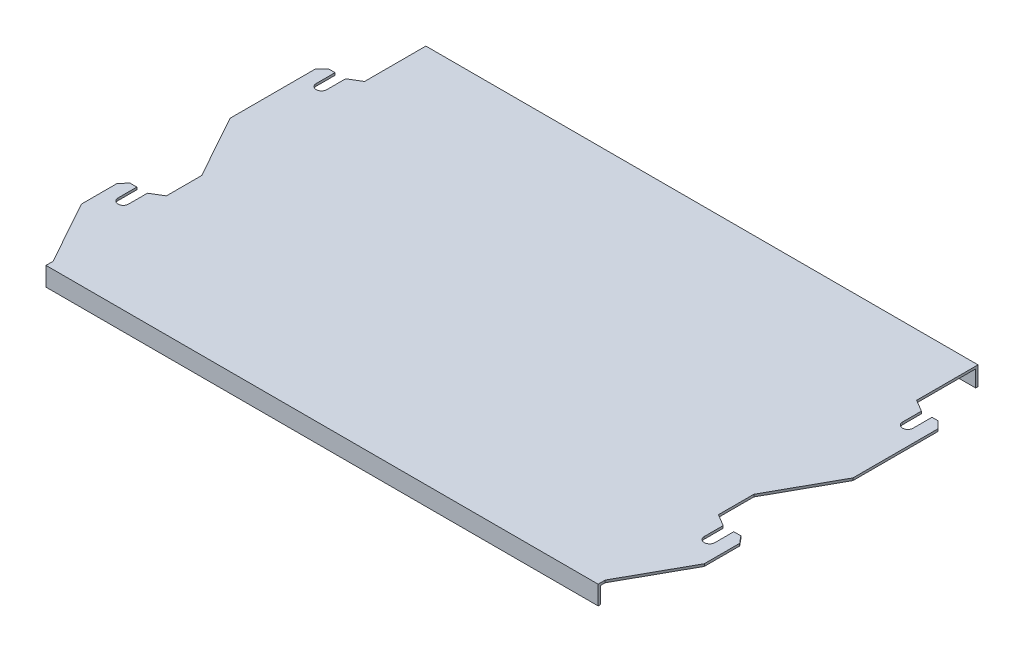
from build123d import *

# Parameters (mm, degrees)
EXTRUDE_THIN1_DEPTH = 132
CUT_EXTRUDE1_DEPTH  = 10


with BuildPart() as part:
    # Sketch1 → Extrude-Thin1 (new, symmetric)
    with BuildSketch(Plane(origin=(0, 0, 0), x_dir=(0, 0, -1), z_dir=(1, 0, 0))):
        Polygon((-80.5, -8), (-80.5, 0), (80.5, 0), (80.5, -8), (79.5, -8), (79.5, -1), (-79.5, -1), (-79.5, -8), align=None)
    extrude(amount=EXTRUDE_THIN1_DEPTH, both=True)

    # Sketch2 → Cut-Extrude1 (cut)
    with BuildSketch(Plane(origin=(0, 0, 0), x_dir=(1, 0, 0), z_dir=(0, 1, 0))):
        with BuildLine():
            Line((-117, 80.5), (-117, 54.5))
            Line((-117, 54.5), (-122, 51.5))
            Line((-122, 51.5), (-122, 43.5))
            ThreePointArc((-122, 43.5), (-124.25, 41.25), (-126.5, 43.5))
            Line((-126.5, 43.5), (-126.5, 51.5))
            Line((-126.5, 51.5), (-129, 51.5))
            Line((-129, 51.5), (-132, 48.5))
            Line((-132, 48.5), (-132, 12.5))
            Line((-132, 12.5), (-117, -14.5))
            Line((-117, -14.5), (-117, -29.5))
            Line((-117, -29.5), (-122, -32.5))
            Line((-122, -32.5), (-122, -40.5))
            ThreePointArc((-122, -40.5), (-124.25, -42.75), (-126.5, -40.5))
            Line((-126.5, -40.5), (-126.5, -32.5))
            Line((-126.5, -32.5), (-129.5, -32.5))
            Line((-129.5, -32.5), (-132, -35.5))
            Line((-132, -35.5), (-132, -50.5))
            Line((-132, -50.5), (-117, -77.5))
            Line((-117, -77.5), (-117, -80.5))
            Line((-117, -80.5), (-140, -80.5))
            Line((-140, -80.5), (-140, 80.5))
            Line((-140, 80.5), (-117, 80.5))
        make_face()
    cut_extrude1 = extrude(amount=-CUT_EXTRUDE1_DEPTH, mode=Mode.SUBTRACT)

    # Mirror1: Cut-Extrude1 across plane
    add(cut_extrude1.mirror(Plane(origin=(0, 0, 0), x_dir=(0, 0, 1), z_dir=(1, 0, 0))), mode=Mode.SUBTRACT)


solid = part.part
